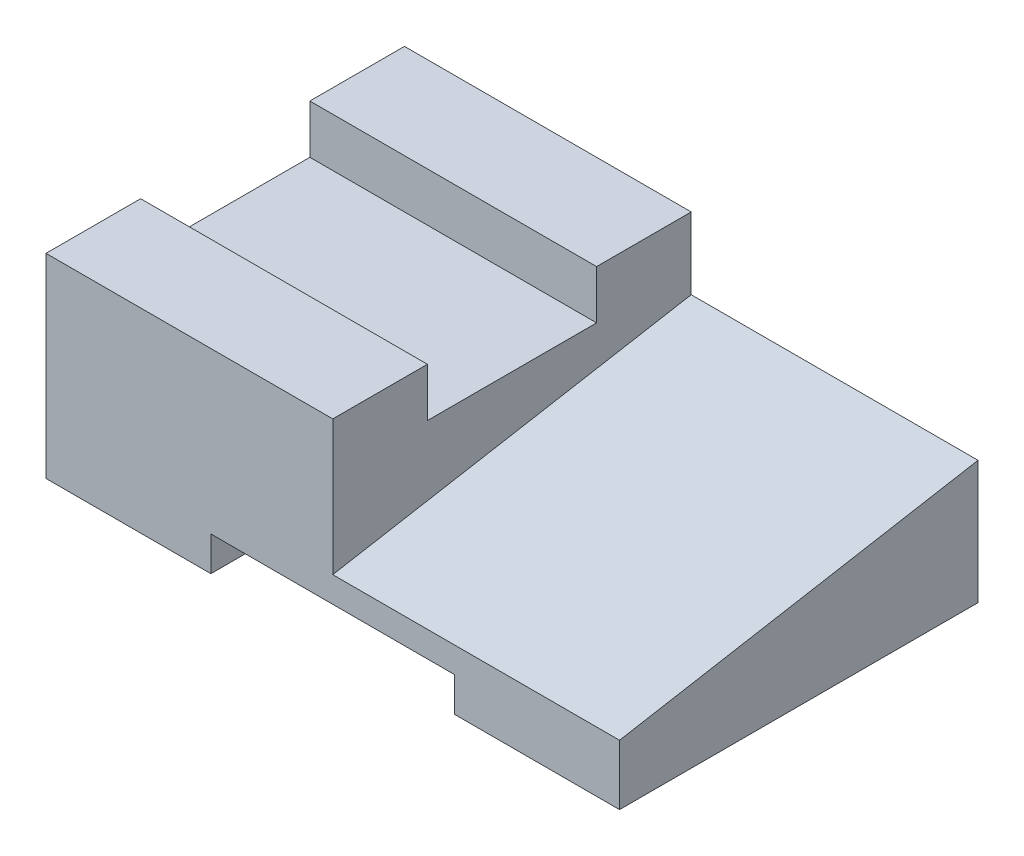
from build123d import *

# Parameters (mm, degrees)
BOSS_EXTRUDE1_DEPTH = 125
CUT_EXTRUDE1_DEPTH  = 100
SKETCH2_3_W         = 59
SKETCH2_3_H         = 17
CUT_EXTRUDE2_DEPTH  = 246.456717162


with BuildPart() as part:
    # Sketch1 → Boss-Extrude1 (new body)
    with BuildSketch(Plane.XY):
        Polygon((-100, 68), (-100, 0), (-42.5, 0), (-42.5, 12), (42.5, 12), (42.5, 0), (100, 0), (100, 68), align=None)
    extrude(amount=-BOSS_EXTRUDE1_DEPTH)

    # Sketch2 → Cut-Extrude1 (cut)
    with BuildSketch(Plane(origin=(100, 0, 0), x_dir=(0, 0, -1), z_dir=(1, 0, 0))):
        Polygon((0, 68), (0, 20.959127411), (125, 43), (125, 68), align=None)
    extrude(amount=-CUT_EXTRUDE1_DEPTH, mode=Mode.SUBTRACT)

    # Sketch2<3> → Cut-Extrude2 (cut, through all)
    with BuildSketch(Plane(origin=(100, 0, 0), x_dir=(0, 0, -1), z_dir=(1, 0, 0))):
        with Locations((62.5, 59.5)):
            Rectangle(SKETCH2_3_W, SKETCH2_3_H)
    extrude(amount=-CUT_EXTRUDE2_DEPTH, mode=Mode.SUBTRACT)


solid = part.part
